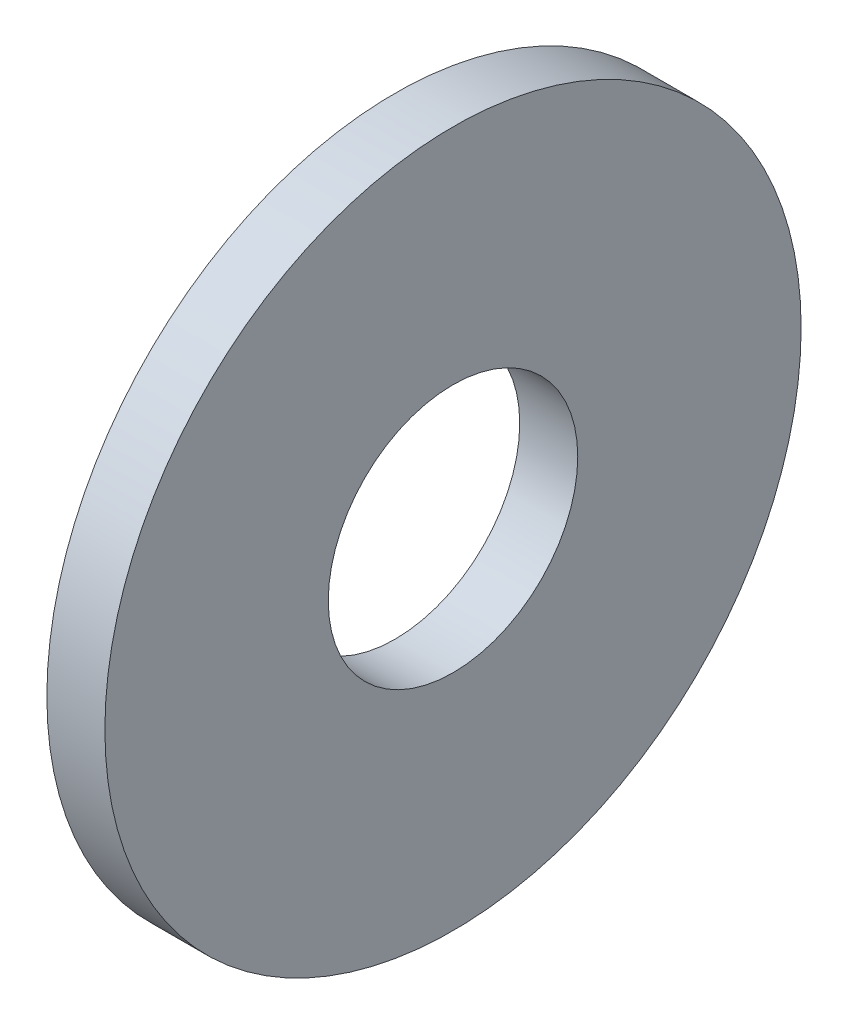
from build123d import *

# Parameters (mm, degrees)
SKETCH1_W = 1
SKETCH1_H = 3.85


with BuildPart() as part:
    # Sketch1 → Base-Revolve (revolve)
    with BuildSketch(Plane.XY, mode=Mode.PRIVATE) as base_revolve_sk:
        with Locations((-0.5, 4.075)):
            Rectangle(SKETCH1_W, SKETCH1_H)
    revolve(base_revolve_sk.sketch.rotate(Axis((-34.925, 0, 0), (1, 0, 0)), 90), axis=Axis((-34.925, 0, 0), (1, 0, 0)))


solid = part.part
